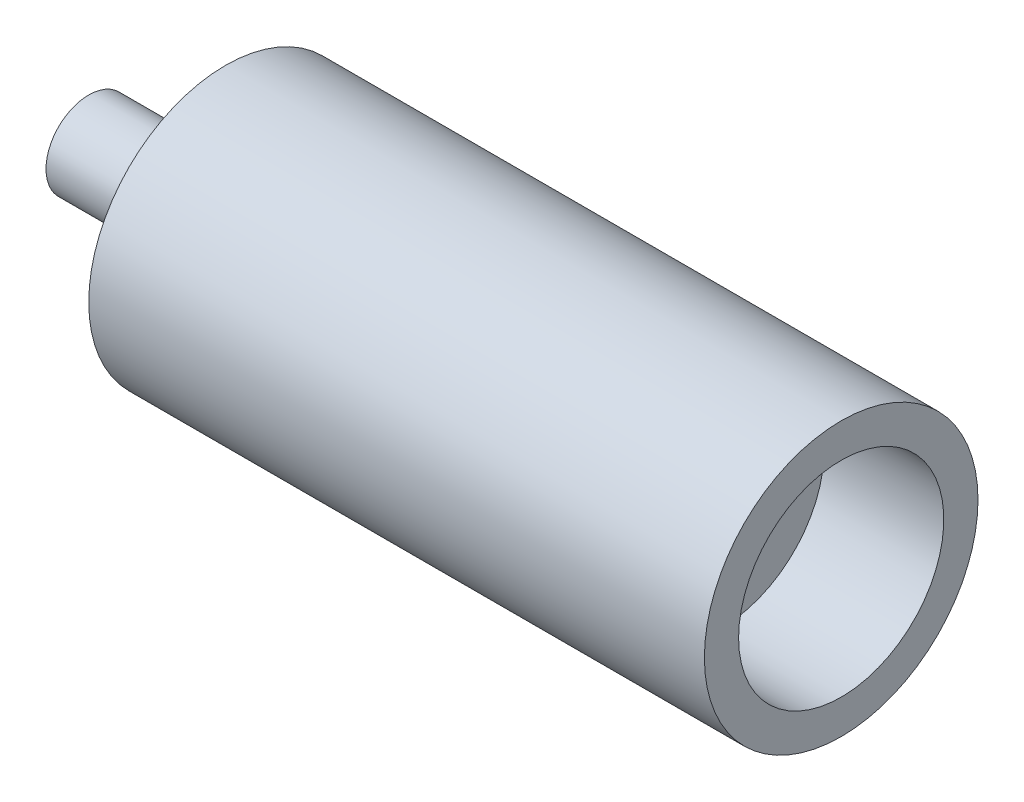
from build123d import *


with BuildPart() as part:
    # Sketch2 → Revolve1 (revolve)
    with BuildSketch(Plane.XY, mode=Mode.PRIVATE) as revolve1_sk:
        Polygon((0, 0), (0, 12.5), (30, 12.5), (30, 20), (33, 25), (35, 25), (35, 32.5), (40, 32.5), (40, 40), (220, 40), (220, 30), (185, 30), (185, 0), align=None)
    revolve(revolve1_sk.sketch.rotate(Axis((37.760080772, 0, 0), (1, 0, 0)), 90), axis=Axis((37.760080772, 0, 0), (1, 0, 0)))


solid = part.part
